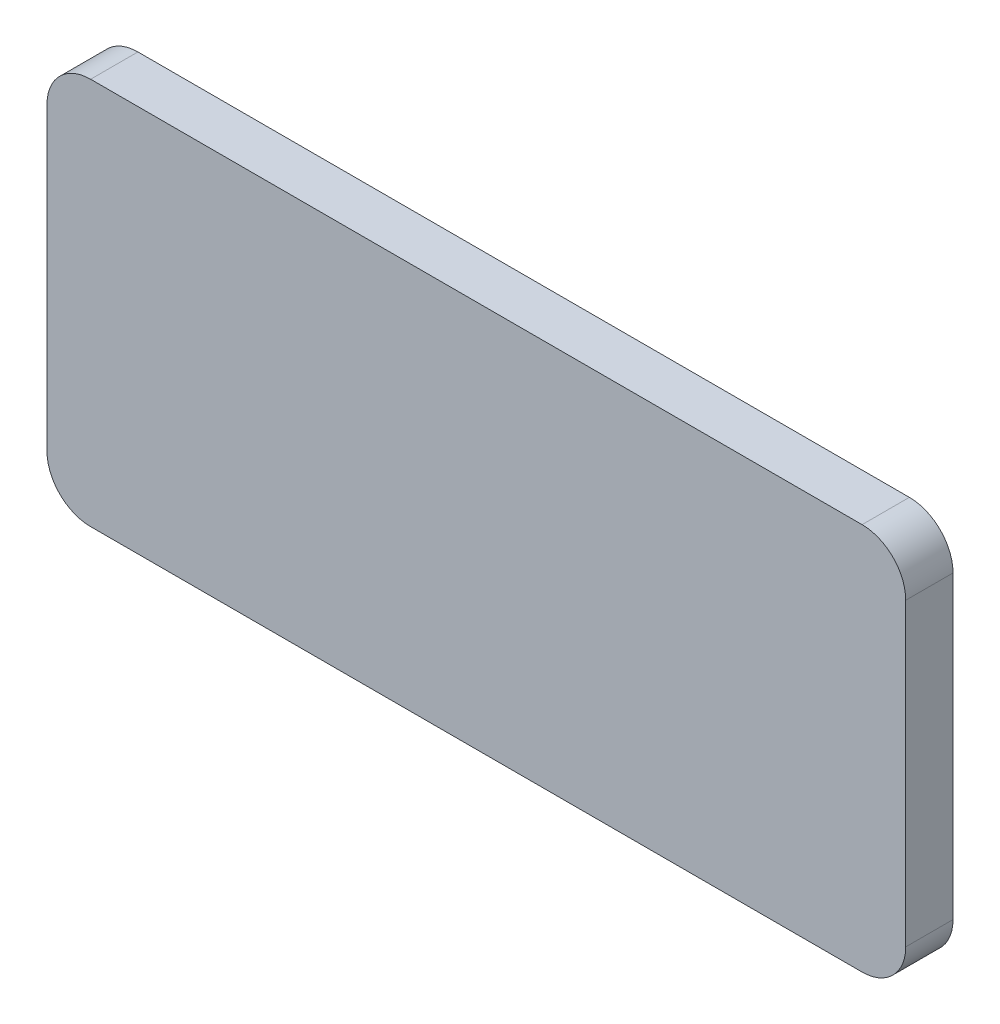
from build123d import *

# Parameters (mm, degrees)
BOSS_EXTRU_1_DEPTH      = 3
ENL_V_MAT_EXTRU_1_DEPTH = 10


with BuildPart() as part:
    # Esquisse1 → Boss.-Extru.1 (new body)
    with BuildSketch(Plane.XY):
        with BuildLine():
            Line((-24.48, -12.295456128), (24.48, -12.295456128))
            ThreePointArc((24.48, -12.295456128), (26.438685784, -11.484141912), (27.25, -9.525456128))
            Line((27.25, -9.525456128), (27.25, 9.525456128))
            ThreePointArc((27.25, 9.525456128), (26.438685784, 11.484141912), (24.48, 12.295456128))
            Line((24.48, 12.295456128), (-24.48, 12.295456128))
            ThreePointArc((-24.48, 12.295456128), (-26.438685784, 11.484141912), (-27.25, 9.525456128))
            Line((-27.25, 9.525456128), (-27.25, -9.525456128))
            ThreePointArc((-27.25, -9.525456128), (-26.438685784, -11.484141912), (-24.48, -12.295456128))
        make_face()
    extrude(amount=BOSS_EXTRU_1_DEPTH)

    # Esquisse2 → Enlèv. mat.-Extru.1 (cut)
    with BuildSketch(Plane.XY.offset(3)):
        Polygon((-124.144777094, 12.295456128), (-15.503134042, 12.295456128), (-6.903134042, 12.295456128), (101.73850901, 12.295456128), (101.73850901, 229.578742232), (-124.144777094, 229.578742232), align=None)
    extrude(amount=-ENL_V_MAT_EXTRU_1_DEPTH, mode=Mode.SUBTRACT)


solid = part.part
